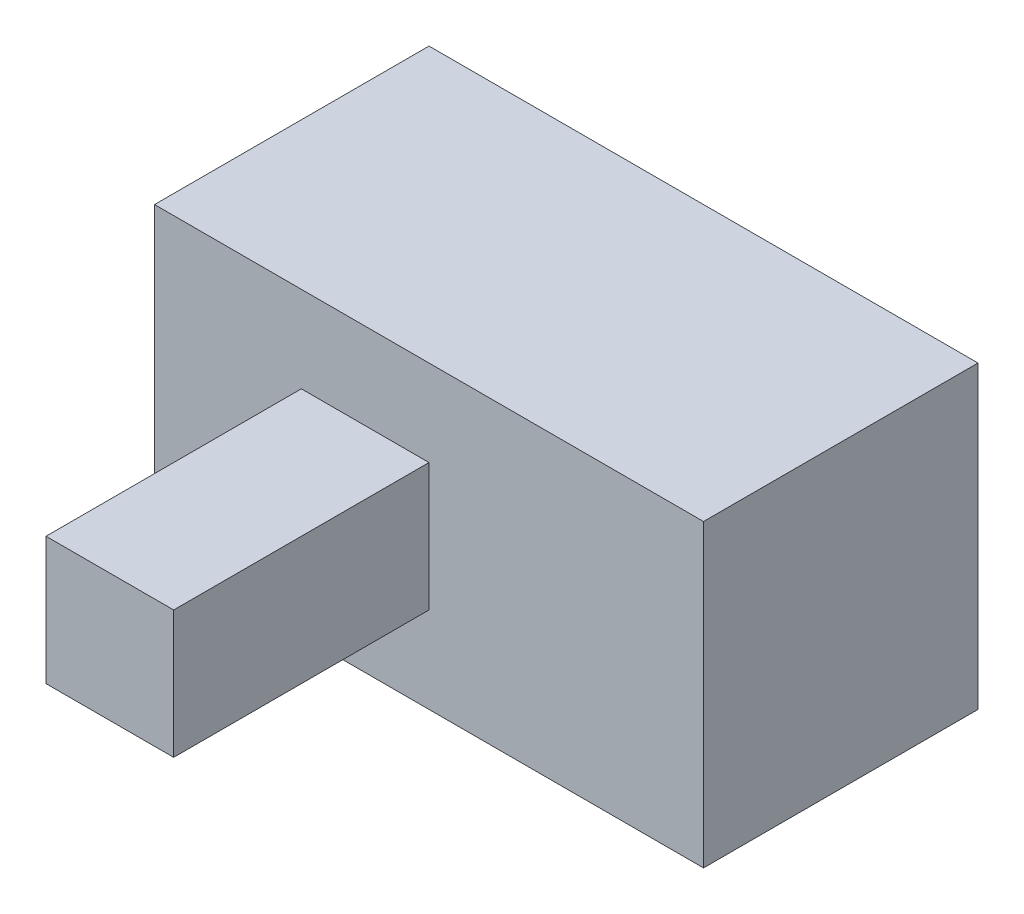
from build123d import *

# Parameters (mm, degrees)
SKETCH1_W           = 8.6
SKETCH1_H           = 4.3
BOSS_EXTRUDE1_DEPTH = 4.7
SKETCH2_W           = 2
SKETCH2_H           = 2
BOSS_EXTRUDE2_DEPTH = 4
SKETCH3_R           = 0.4
BOSS_EXTRUDE3_DEPTH = 1.5


with BuildPart() as part:
    # Sketch1 → Boss-Extrude1 (new body)
    with BuildSketch(Plane(origin=(0, 0, 0), x_dir=(1, 0, 0), z_dir=(0, 1, 0))):
        Rectangle(SKETCH1_W, SKETCH1_H)
    extrude(amount=BOSS_EXTRUDE1_DEPTH)

    # Sketch2 → Boss-Extrude2 (add)
    with BuildSketch(Plane.XY.offset(2.15)):
        with Locations((-1, 2.35)):
            Rectangle(SKETCH2_W, SKETCH2_H)
    extrude(amount=BOSS_EXTRUDE2_DEPTH)

    # Sketch3 → Boss-Extrude3 (add)
    with BuildSketch(Plane.XZ):
        with Locations(Location((-2, 0, 0), (0, 0, 270))):
            Circle(SKETCH3_R)
        with Locations(Location((0, 0, 0), (0, 0, 270))):
            Circle(SKETCH3_R)
        with Locations(Location((2, 0, 0), (0, 0, 270))):
            Circle(SKETCH3_R)
    extrude(amount=BOSS_EXTRUDE3_DEPTH)


solid = part.part
